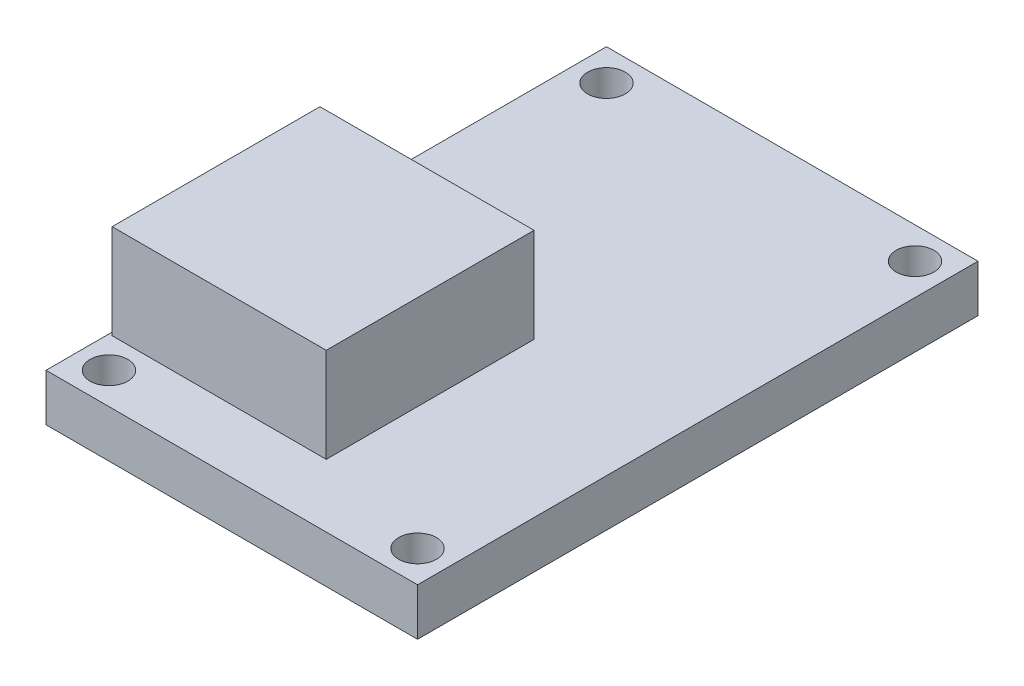
from build123d import *

# Parameters (mm, degrees)
SKETCH1_W           = 11.8
SKETCH1_H           = 17.8
SKETCH1_R           = 0.6
BOSS_EXTRUDE1_DEPTH = 1.5
SKETCH2_W           = 6.8
SKETCH2_H           = 6.6
BOSS_EXTRUDE2_DEPTH = 3


with BuildPart() as part:
    # Sketch1 → Boss-Extrude1 (new body)
    with BuildSketch(Plane(origin=(0, 0, 0), x_dir=(1, 0, 0), z_dir=(0, 1, 0))):
        Rectangle(SKETCH1_W, SKETCH1_H)
        with Locations(Location((-4.9, 7.9, 0), (0, 0, 270))):
            Circle(SKETCH1_R, mode=Mode.SUBTRACT)
        with Locations(Location((4.9, 7.9, 0), (0, 0, 270))):
            Circle(SKETCH1_R, mode=Mode.SUBTRACT)
        with Locations(Location((4.9, -7.9, 0), (0, 0, 270))):
            Circle(SKETCH1_R, mode=Mode.SUBTRACT)
        with Locations(Location((-4.9, -7.9, 0), (0, 0, 270))):
            Circle(SKETCH1_R, mode=Mode.SUBTRACT)
    extrude(amount=BOSS_EXTRUDE1_DEPTH)

    # Sketch2 → Boss-Extrude2 (add)
    with BuildSketch(Plane(origin=(0, 1.5, 0), x_dir=(1, 0, 0), z_dir=(0, 1, 0))):
        with Locations((-2.4, -3.6)):
            Rectangle(SKETCH2_W, SKETCH2_H)
    extrude(amount=BOSS_EXTRUDE2_DEPTH)


solid = part.part
